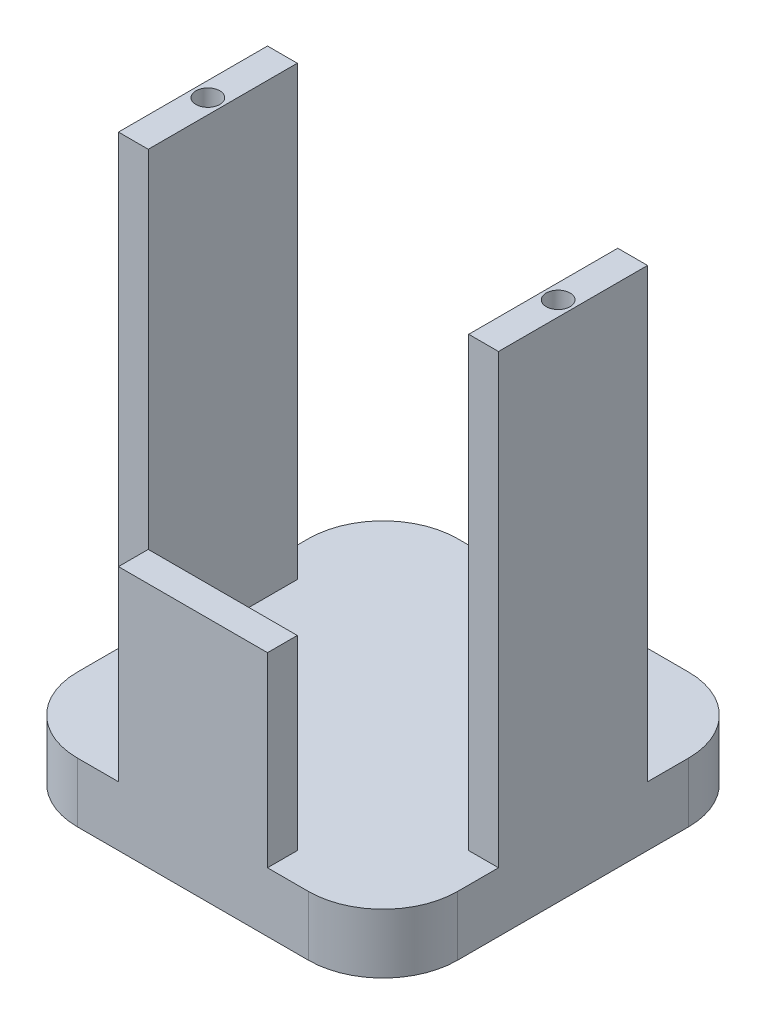
from build123d import *

# Parameters (mm, degrees)
ESBO_O1_W                = 51
ESBO_O1_H                = 51
RESSALTO_EXTRUS_O1_DEPTH = 8
ESBO_O2_W                = 4
ESBO_O2_H                = 20
RESSALTO_EXTRUS_O2_DEPTH = 60
ESBO_O3_R                = 1.6
CORTE_EXTRUS_O1_DEPTH    = 7
ESBO_O4_W                = 20
ESBO_O4_H                = 4
RESSALTO_EXTRUS_O3_DEPTH = 25
ESBO_O5_R                = 1.6
CORTE_EXTRUS_O2_DEPTH    = 7
FILETE2_R                = 10


with BuildPart() as part:
    # Esboço1 → Ressalto-extrusão1 (new body)
    with BuildSketch(Plane(origin=(0, 0, 0), x_dir=(1, 0, 0), z_dir=(0, 1, 0))):
        Rectangle(ESBO_O1_W, ESBO_O1_H)
    extrude(amount=RESSALTO_EXTRUS_O1_DEPTH)

    # Esboço2 → Ressalto-extrusão2 (add)
    with BuildSketch(Plane(origin=(0, 8, 0), x_dir=(1, 0, 0), z_dir=(0, 1, 0))):
        with Locations((-23.5, 0)):
            Rectangle(ESBO_O2_W, ESBO_O2_H)
        with Locations((23.5, 0)):
            Rectangle(ESBO_O2_W, ESBO_O2_H)
    extrude(amount=RESSALTO_EXTRUS_O2_DEPTH)

    # Esboço3 → Corte-extrusão1 (cut)
    with BuildSketch(Plane(origin=(0, 68, 0), x_dir=(1, 0, 0), z_dir=(0, 1, 0))):
        with Locations(Location((-23.5, 0, 0), (0, 0, 270))):
            Circle(ESBO_O3_R)
        with Locations(Location((23.5, 0, 0), (0, 0, 90))):
            Circle(ESBO_O3_R)
    extrude(amount=-CORTE_EXTRUS_O1_DEPTH, mode=Mode.SUBTRACT)

    # Esboço4 → Ressalto-extrusão3 (add)
    with BuildSketch(Plane(origin=(0, 8, 0), x_dir=(1, 0, 0), z_dir=(0, 1, 0))):
        with Locations((0, 23.5)):
            Rectangle(ESBO_O4_W, ESBO_O4_H)
        with Locations((0, -23.5)):
            Rectangle(ESBO_O4_W, ESBO_O4_H)
    extrude(amount=RESSALTO_EXTRUS_O3_DEPTH)

    # Esboço5 → Corte-extrusão2 (cut)
    with BuildSketch(Plane.XZ):
        with Locations(Location((-11, 11, 0), (0, 0, 270))):
            Circle(ESBO_O5_R)
        with Locations(Location((11, 11, 0), (0, 0, 90))):
            Circle(ESBO_O5_R)
        with Locations(Location((11, -11, 0), (0, 0, 270))):
            Circle(ESBO_O5_R)
        with Locations(Location((-11, -11, 0), (0, 0, 90))):
            Circle(ESBO_O5_R)
    extrude(amount=-CORTE_EXTRUS_O2_DEPTH, mode=Mode.SUBTRACT)

    # Filete2
    filete2_edges = [part.edges().sort_by_distance(p)[0] for p in [
        (25.5, 4, 25.5),
        (-25.5, 4, 25.5),
        (-25.5, 4, -25.5),
        (25.5, 4, -25.5),
    ]]
    fillet(filete2_edges, radius=FILETE2_R)


solid = part.part
